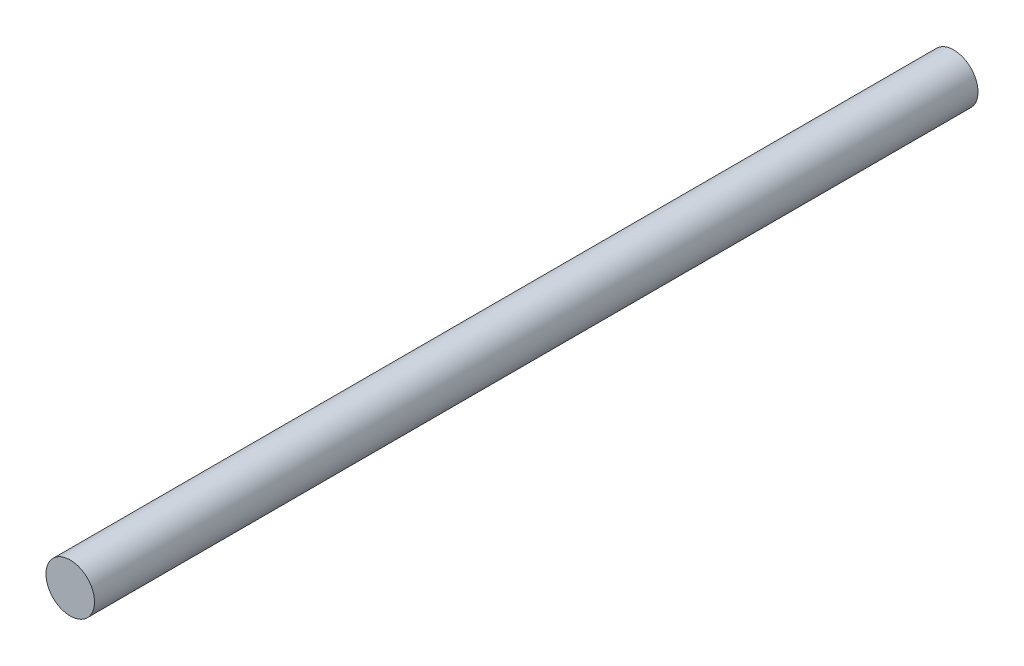
from build123d import *

# Parameters (mm, degrees)
SKETCH1_R           = 5
BOSS_EXTRUDE1_DEPTH = 182


with BuildPart() as part:
    # Sketch1 → Boss-Extrude1 (new body)
    with BuildSketch(Plane.XY):
        Circle(SKETCH1_R)
    extrude(amount=BOSS_EXTRUDE1_DEPTH)


solid = part.part
